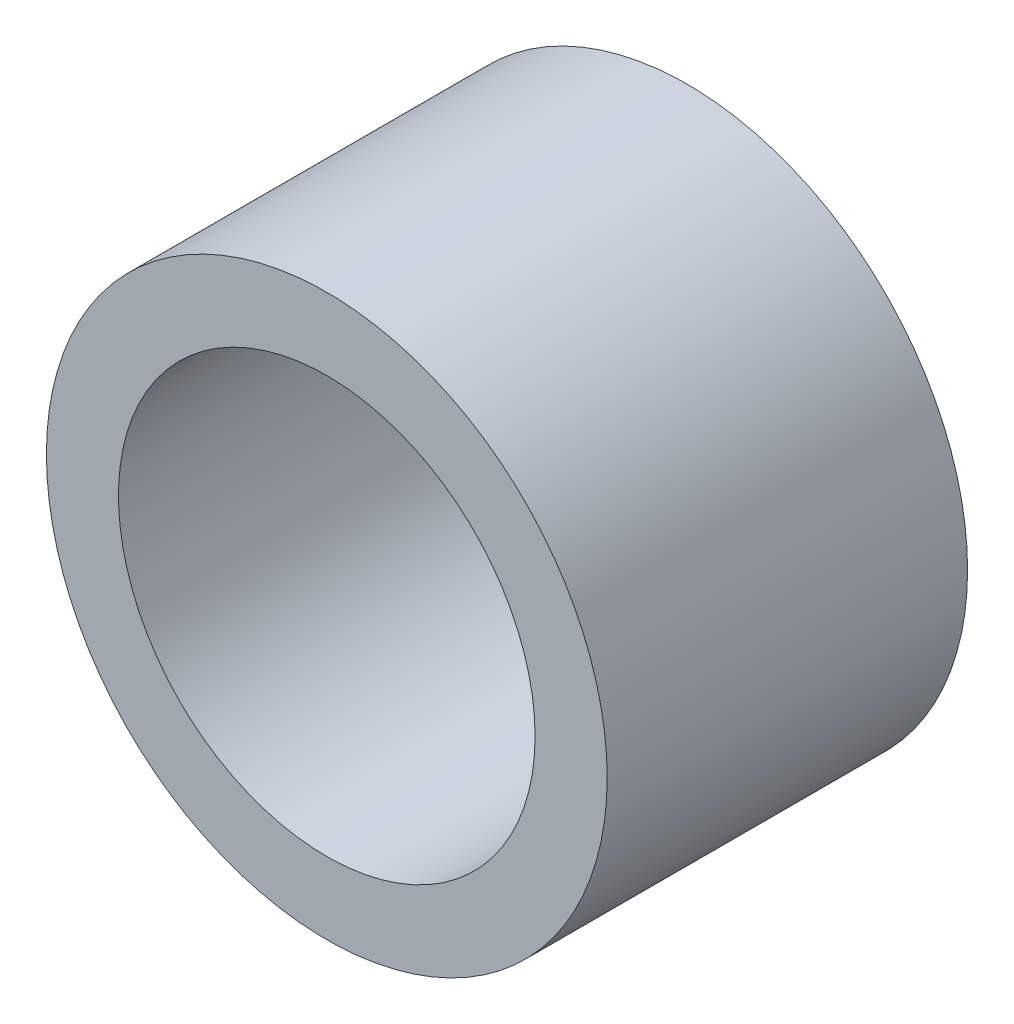
from build123d import *

# Parameters (mm, degrees)
SCHIZZO1_R                   = 3.89
SCHIZZO1_R_2                 = 2.89
ESTRUSIONE_ESTRUSIONE1_DEPTH = 5


with BuildPart() as part:
    # Schizzo1 → Estrusione-Estrusione1 (new body)
    with BuildSketch(Plane.XY):
        Circle(SCHIZZO1_R)
        Circle(SCHIZZO1_R_2, mode=Mode.SUBTRACT)
    extrude(amount=ESTRUSIONE_ESTRUSIONE1_DEPTH)


solid = part.part
